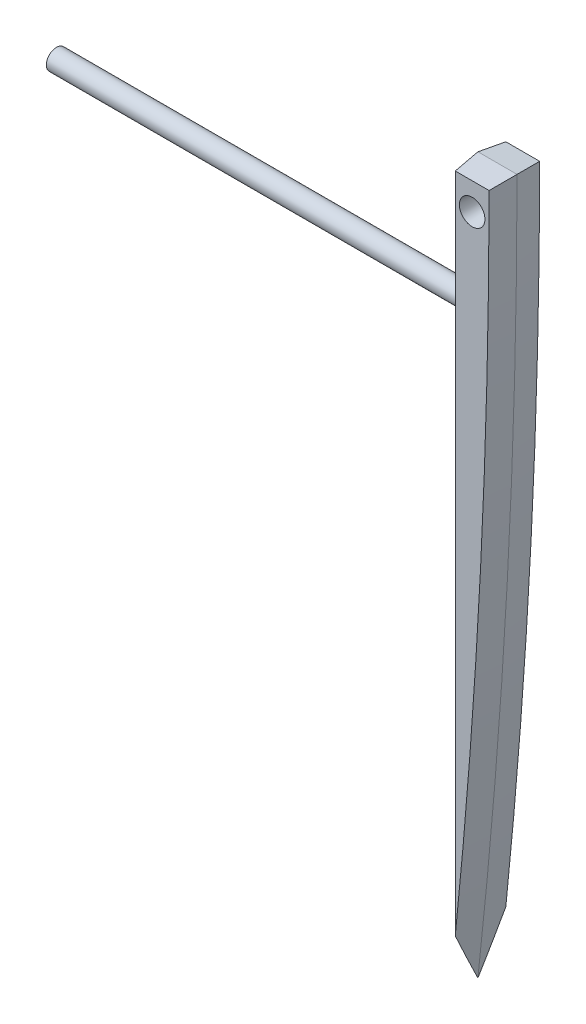
from build123d import *

# Parameters (mm, degrees)
SKETCH1_R                     = 1
BOSS_EXTRUDE1_DEPTH           = 2.5
BOSS_EXTRUDE1_DRAFT           = 6
BOSS_EXTRUDE1_OTHER_WAY_DEPTH = 2.5
BOSS_EXTRUDE1_OTHER_WAY_DRAFT = -6
SKETCH2_R                     = 1


with BuildPart() as part:
    # Sketch1 → Boss-Extrude1 (with draft: the straight prism first)
    with BuildSketch(Plane.XY):
        with BuildLine():
            Line((0, 37.120938716), (0, -33.585611219))
            ThreePointArc((0, -33.585611219), (2.89935164, 1.714837296), (3.86676445, 37.120938716))
            Line((3.86676445, 37.120938716), (0, 37.120938716))
        make_face()
        with Locations((1.933382225, 34.186107729)):
            Circle(SKETCH1_R, mode=Mode.SUBTRACT)
    extrude(amount=BOSS_EXTRUDE1_DEPTH)
    # Boss-Extrude1: the draft: its side faces are tilted about the plane it starts from
    boss_extrude1_sides = [part.faces().sort_by_distance(p)[0] for p in [
        (1.933382225, 37.120938716, 1.25),
        (0, 1.767663748, 1.25),
        (2.89935164, 1.714837296, 1.25),
        (0.933382225, 34.186107729, 1.25),
    ]]
    draft(boss_extrude1_sides, Plane.XY, BOSS_EXTRUDE1_DRAFT)


with BuildPart() as boss_extrude1_other_way_tool:
    # Sketch1 → Boss-Extrude1 other way (with draft: the straight prism first)
    with BuildSketch(Plane.XY):
        with BuildLine():
            Line((0, 37.120938716), (0, -33.585611219))
            ThreePointArc((0, -33.585611219), (2.89935164, 1.714837296), (3.86676445, 37.120938716))
            Line((3.86676445, 37.120938716), (0, 37.120938716))
        make_face()
        with Locations((1.933382225, 34.186107729)):
            Circle(SKETCH1_R, mode=Mode.SUBTRACT)
    extrude(amount=-BOSS_EXTRUDE1_OTHER_WAY_DEPTH)
    # Boss-Extrude1 other way: the draft: its side faces are tilted about the plane it starts from
    boss_extrude1_other_way_sides = [boss_extrude1_other_way_tool.faces().sort_by_distance(p)[0] for p in [
        (1.933382225, 37.120938716, -1.25),
        (0, 1.767663748, -1.25),
        (2.89935164, 1.714837296, -1.25),
        (0.933382225, 34.186107729, -1.25),
    ]]
    draft(boss_extrude1_other_way_sides, Plane.XY, BOSS_EXTRUDE1_OTHER_WAY_DRAFT)


with BuildPart() as part_1:
    add(part.part)

    # Boss-Extrude1 other way: add boss_extrude1_other_way_tool
    add(boss_extrude1_other_way_tool.part)


with BuildPart() as body_2:
    # Sweep1: sweep along a path in Sketch3
    with BuildLine(Plane.XY) as sweep1_path:
        Line((0, 28.760399507), (-41.648385585, 28.760399507))
    # Sketch2 → Sweep1 (sweep)
    with BuildSketch(Plane(origin=(0, 0, 0), x_dir=(0, 0, -1), z_dir=(1, 0, 0))):
        with Locations((0, 24.23081472)):
            Circle(SKETCH2_R)
    sweep(path=sweep1_path.line)


solid = Compound([part_1.part, body_2.part])
